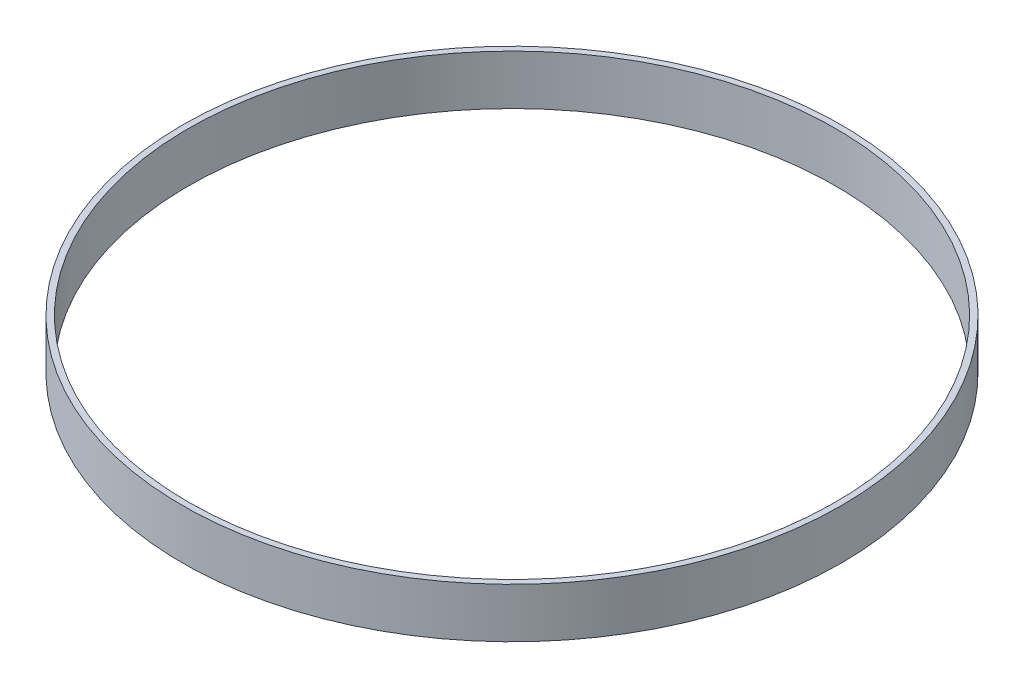
from build123d import *

# Parameters (mm, degrees)
SKETCH1_R           = 66.2
SKETCH1_R_2         = 65
EXTRUDE_THIN1_DEPTH = 10


with BuildPart() as part:
    # Sketch1 → Extrude-Thin1 (new body)
    with BuildSketch(Plane(origin=(0, 0, 0), x_dir=(1, 0, 0), z_dir=(0, 1, 0))):
        Circle(SKETCH1_R)
        Circle(SKETCH1_R_2, mode=Mode.SUBTRACT)
    extrude(amount=EXTRUDE_THIN1_DEPTH)


solid = part.part
